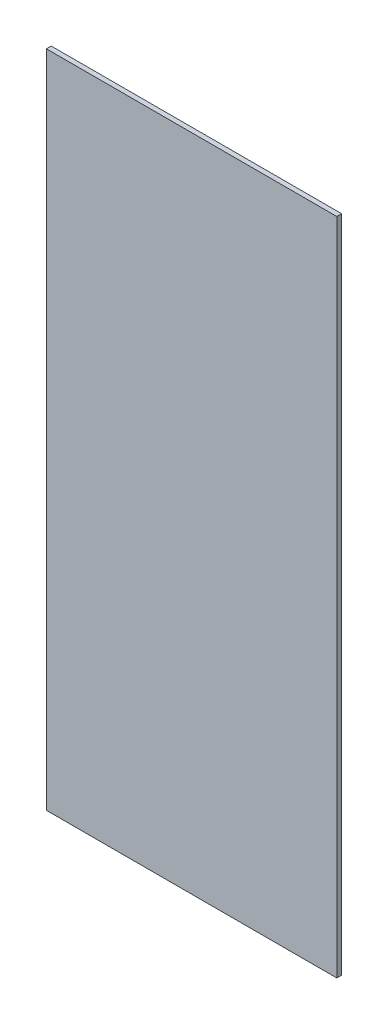
from build123d import *

# Parameters (mm, degrees)
SKETCH1_W           = 181
SKETCH1_H           = 411
BOSS_EXTRUDE1_DEPTH = 3


with BuildPart() as part:
    # Sketch1 → Boss-Extrude1 (new body)
    with BuildSketch(Plane.XY):
        with Locations((-87.5, 202.5)):
            Rectangle(SKETCH1_W, SKETCH1_H)
    extrude(amount=BOSS_EXTRUDE1_DEPTH)


solid = part.part
